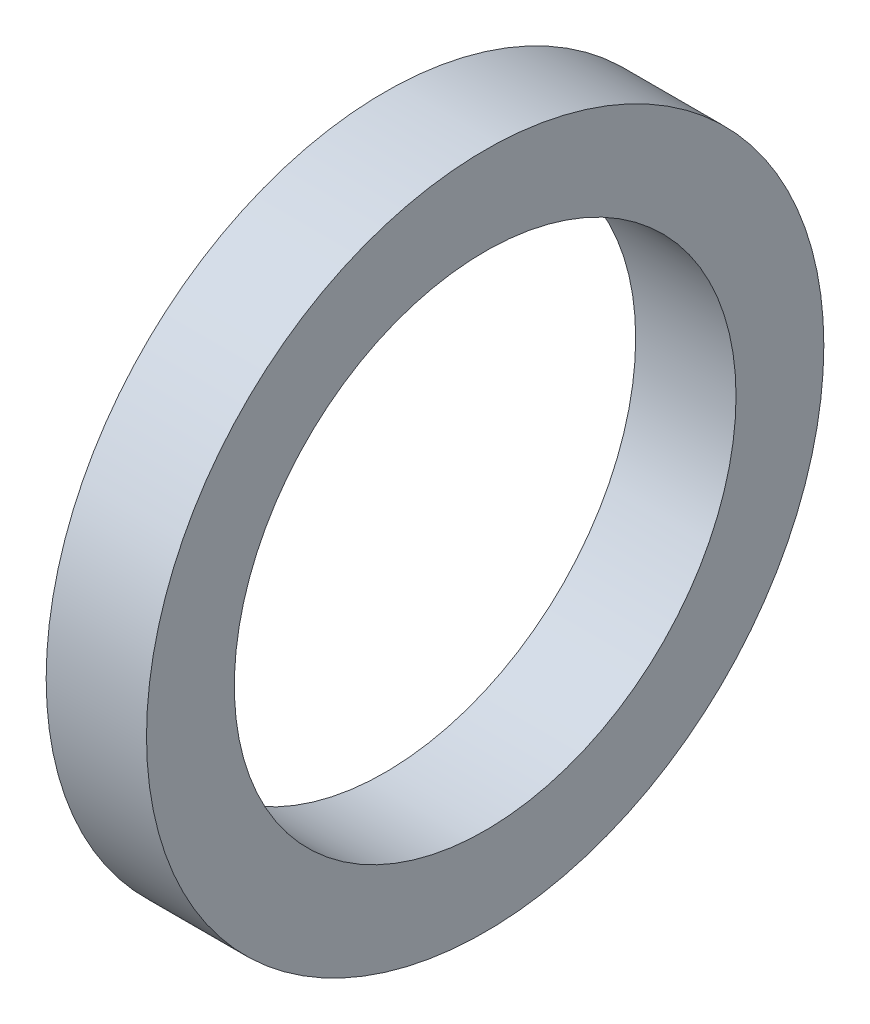
from build123d import *

# Parameters (mm, degrees)
SKETCH_1_R      = 13.5
SKETCH_1_R_2    = 10
EXTRUDE_1_DEPTH = 2


with BuildPart() as part:
    # 草图1 → 凸台-拉伸1 (new, symmetric)
    with BuildSketch(Plane(origin=(0, 0, 0), x_dir=(0, 0, -1), z_dir=(1, 0, 0))):
        Circle(SKETCH_1_R)
        Circle(SKETCH_1_R_2, mode=Mode.SUBTRACT)
    extrude(amount=EXTRUDE_1_DEPTH, both=True)


solid = part.part
